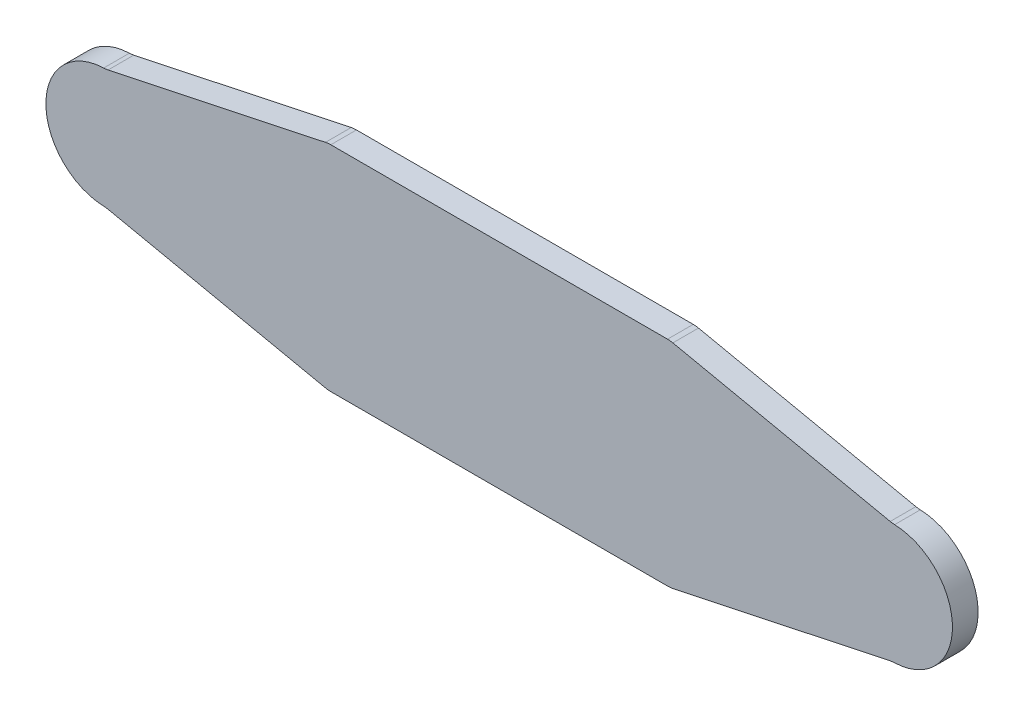
from build123d import *

# Parameters (mm, degrees)
BOSS_EXTRUDE1_DEPTH = 3
FILLET1_R           = 3


with BuildPart() as part:
    # Sketch1 → Boss-Extrude1 (new body)
    with BuildSketch(Plane.XY):
        with BuildLine():
            Line((0, 0), (40, 0))
            Line((40, 0), (66, -5.5))
            ThreePointArc((66, -5.5), (73, -12.5), (66, -19.5))
            Line((66, -19.5), (40, -25))
            Line((40, -25), (0, -25))
            Line((0, -25), (-26, -19.5))
            ThreePointArc((-26, -19.5), (-33, -12.5), (-26, -5.5))
            Line((-26, -5.5), (0, 0))
        make_face()
    extrude(amount=BOSS_EXTRUDE1_DEPTH)

    # Fillet1
    fillet1_edges = [part.edges().sort_by_distance(p)[0] for p in [
        (0, 0, 1.5),
        (40, 0, 1.5),
        (66, -5.5, 1.5),
        (66, -19.5, 1.5),
        (40, -25, 1.5),
        (0, -25, 1.5),
        (-26, -19.5, 1.5),
        (-26, -5.5, 1.5),
    ]]
    fillet(fillet1_edges, radius=FILLET1_R)


solid = part.part
